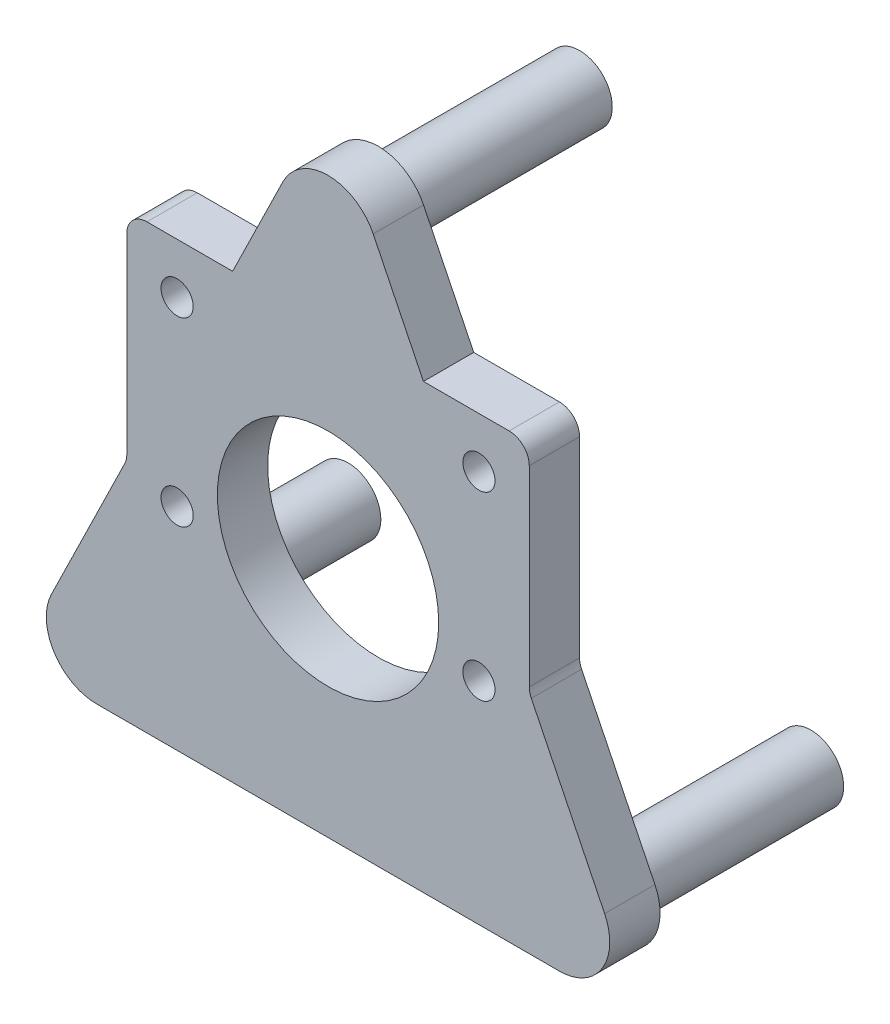
from build123d import *

# Parameters (mm, degrees)
SKETCH_1_R          = 11
EXTRUDE_1_DEPTH     = 5
SKETCH_2_R          = 3.25
EXTRUDE_2_DEPTH     = 20
FILLET_1_R          = 1
EXTRUDE_3_DEPTH     = 5
FILLET_2_R          = 2
SKETCH_4_R          = 1.6
CUT_EXTRUDE_1_DEPTH = 5


with BuildPart() as part:
    # 草图1 → 凸台-拉伸1 (new body)
    with BuildSketch(Plane.XY):
        with BuildLine():
            Line((-4.49108361, 30.19776432), (-27.49108361, -16.80223568))
            ThreePointArc((-27.49108361, -16.80223568), (-27.241981942, -21.64680736), (-23, -24))
            Line((-23, -24), (23, -24))
            ThreePointArc((23, -24), (27.241981942, -21.64680736), (27.49108361, -16.80223568))
            Line((27.49108361, -16.80223568), (4.49108361, 30.19776432))
            ThreePointArc((4.49108361, 30.19776432), (0, 33), (-4.49108361, 30.19776432))
        make_face()
        Circle(SKETCH_1_R, mode=Mode.SUBTRACT)
    extrude(amount=EXTRUDE_1_DEPTH)

    # 草图2 → 凸台-拉伸2 (add)
    with BuildSketch(Plane(origin=(0, 0, 0), x_dir=(-1, 0, 0), z_dir=(0, 0, -1))):
        with Locations(Location((0, 28, 0), (0, 0, 180))):
            Circle(SKETCH_2_R)
        with Locations(Location((-23, -19, 0), (0, 0, 180))):
            Circle(SKETCH_2_R)
        with Locations(Location((23, -19, 0), (0, 0, 180))):
            Circle(SKETCH_2_R)
    extrude(amount=EXTRUDE_2_DEPTH)

    # 圆角1
    fillet_1_edges = [part.edges().sort_by_distance(p)[0] for p in [
        (-3.25, 28, 0),
        (19.75, -19, 0),
        (-26.25, -19, 0),
    ]]
    fillet(fillet_1_edges, radius=FILLET_1_R)

    # 草图3 → 凸台-拉伸3 (add)
    with BuildSketch(Plane.XY.offset(5)):
        Polygon((-20, 20), (-9.481478916, 20), (-20, -1.494369172), align=None)
        Polygon((20, 20), (20, -1.494369172), (9.481478916, 20), align=None)
    extrude(amount=-EXTRUDE_3_DEPTH)

    # 圆角2
    fillet_2_edges = [part.edges().sort_by_distance(p)[0] for p in [
        (-20, -1.494369172, 2.5),
        (-20, 20, 2.5),
        (20, 20, 2.5),
        (20, -1.494369172, 2.5),
    ]]
    fillet(fillet_2_edges, radius=FILLET_2_R)

    # 草图4 → 切除-拉伸1 (cut)
    with BuildSketch(Plane.XY.offset(5)):
        with Locations((-15, 15)):
            Circle(SKETCH_4_R)
        with Locations((15, 15)):
            Circle(SKETCH_4_R)
        with Locations((15, -3)):
            Circle(SKETCH_4_R)
        with Locations((-15, -3)):
            Circle(SKETCH_4_R)
    extrude(amount=-CUT_EXTRUDE_1_DEPTH, mode=Mode.SUBTRACT)


solid = part.part
